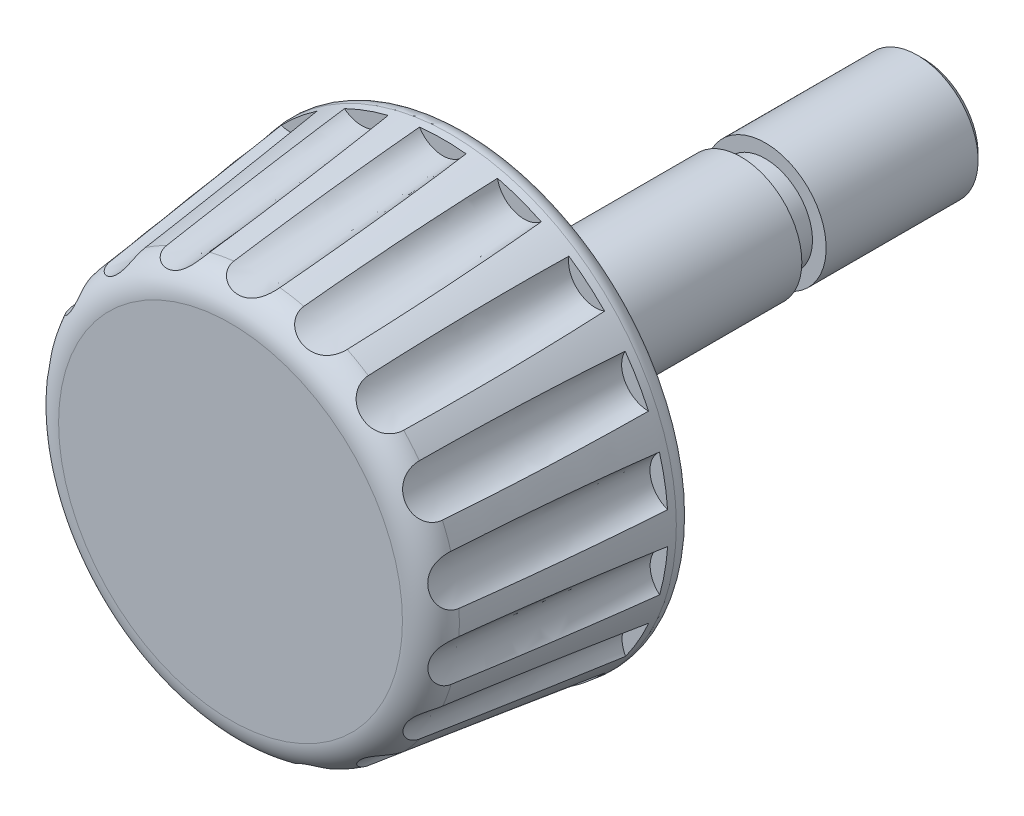
from build123d import *

# Parameters (mm, degrees)
ESQUISSE1_R                  = 7.5
EXTRUSION1_DEPTH             = 7.8
EXTRUSION1_TAPER             = 7
ESQUISSE3_R                  = 2
EXTRUSION3_DEPTH             = 15
CHANFREIN2_SIZE              = 0.2
CONG_1_R                     = 1
ESQUISSE7_R                  = 1.5
ENL_V_MAT_EXTRU_4_DEPTH      = 7
ENL_V_MAT_EXTRU_4_TAPER      = 5
R_P_TITION_CIRCULAIRE1_COUNT = 18
ESQUISSE10_W                 = 1.058649332
ESQUISSE10_H                 = 0.8
CONG_2_R                     = 0.5


with BuildPart() as part:
    # Esquisse1 → Extrusion1 (new body)
    with BuildSketch(Plane.XY):
        Circle(ESQUISSE1_R)
    extrude(amount=EXTRUSION1_DEPTH, taper=EXTRUSION1_TAPER)

    # Esquisse3 → Extrusion3 (add)
    with BuildSketch(Plane(origin=(0, 0, 0), x_dir=(-1, 0, 0), z_dir=(0, 0, -1))):
        with Locations(Location((0, 0, 0), (0, 0, 180))):
            Circle(ESQUISSE3_R)
    extrude(amount=EXTRUSION3_DEPTH)

    # Chanfrein2
    chanfrein2_edges = [part.edges().sort_by_distance(p)[0] for p in [
        (-2, 0, -15),
    ]]
    chamfer(chanfrein2_edges, length=CHANFREIN2_SIZE)

    # Congé1
    cong_1_edges = [part.edges().sort_by_distance(p)[0] for p in [
        (-6.542280425, 0, 7.8),
    ]]
    fillet(cong_1_edges, radius=CONG_1_R)

    # Esquisse7 → Enlèv. mat.-Extru.4 (cut)
    with BuildSketch(Plane.XY.offset(7.8)):
        with Locations((-0.01365609, 7.810890416)):
            Circle(ESQUISSE7_R)
    enl_v_mat_extru_4 = extrude(amount=-ENL_V_MAT_EXTRU_4_DEPTH, taper=ENL_V_MAT_EXTRU_4_TAPER, mode=Mode.SUBTRACT)

    # Répétition circulaire1: Enlèv. mat.-Extru.4 ×18 about axis
    r_p_tition_circulaire1_axis = Axis((0, 0, -15.57), (0, 0, 1))
    for i in range(1, R_P_TITION_CIRCULAIRE1_COUNT):
        add(enl_v_mat_extru_4.rotate(r_p_tition_circulaire1_axis, i * 360 / R_P_TITION_CIRCULAIRE1_COUNT), mode=Mode.SUBTRACT)

    # Esquisse10 → Enlèvement de matière-Révolution1 (revolve, cut)
    with BuildSketch(Plane(origin=(0, 0, 0), x_dir=(1, 0, 0), z_dir=(0, 1, 0)), mode=Mode.PRIVATE) as enl_vement_de_mati_re_r_volution1_sk:
        with Locations((-2.079324666, 9.4)):
            Rectangle(ESQUISSE10_W, ESQUISSE10_H)
    revolve(enl_vement_de_mati_re_r_volution1_sk.sketch.rotate(Axis((0, 0, -15.464703126), (0, 0, 1)), 180), axis=Axis((0, 0, -15.464703126), (0, 0, 1)), mode=Mode.SUBTRACT)

    # Congé2
    cong_2_edges = [part.edges().sort_by_distance(p)[0] for p in [
        (-7.5, 0, 0),
    ]]
    fillet(cong_2_edges, radius=CONG_2_R)


solid = part.part
